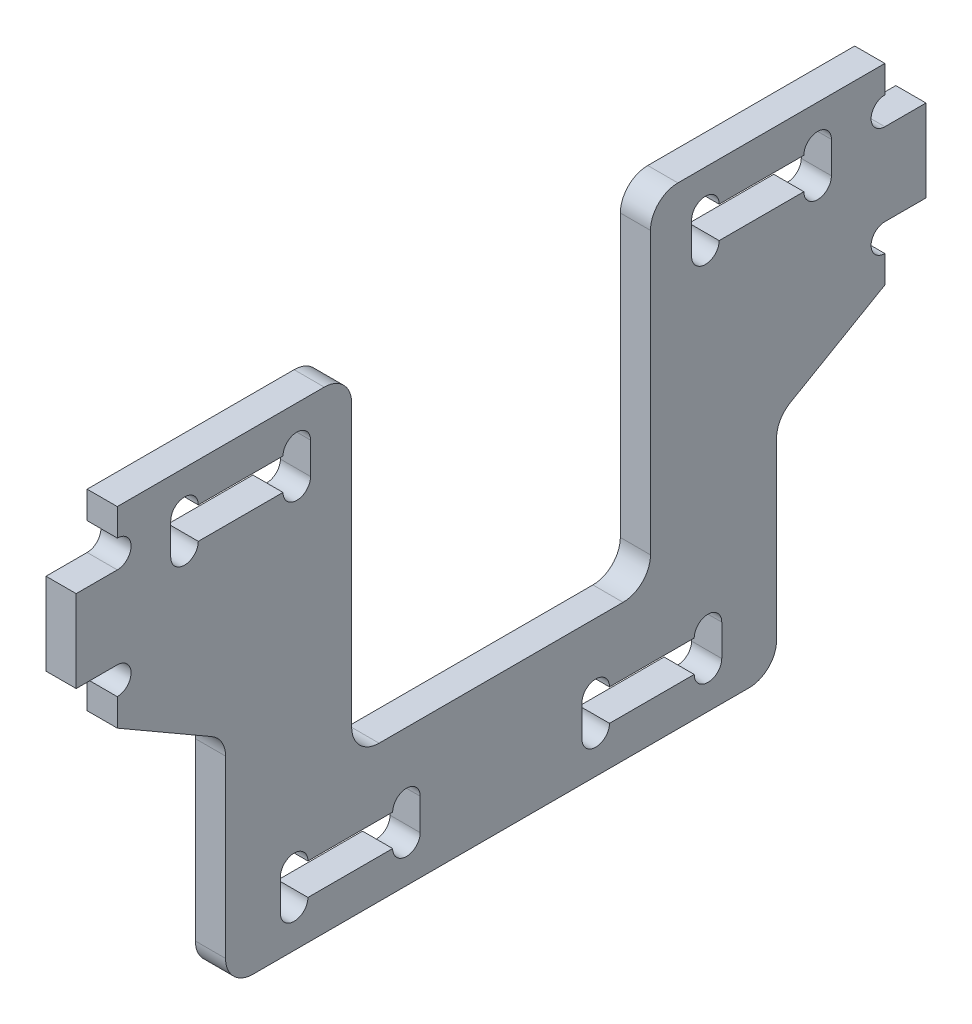
from build123d import *

# Parameters (mm, degrees)
EXTRUDE_1_DEPTH = 2.2
FILLET_1_R      = 2


with BuildPart() as part:
    # 草图1 → 凸台-拉伸1 (new body)
    with BuildSketch(Plane(origin=(0, 0, 0), x_dir=(0, 0, -1), z_dir=(1, 0, 0))):
        with BuildLine():
            Line((-20.1, -17.25), (20.1, -17.25))
            Line((20.1, -17.25), (20.1, -1.311067127))
            Line((20.1, -1.311067127), (28, 3.25))
            Line((28, 3.25), (28, 5.24))
            ThreePointArc((28, 5.24), (26.995, 6.245), (28, 7.25))
            Line((28, 7.25), (31, 7.25))
            Line((31, 7.25), (31, 13.25))
            Line((31, 13.25), (28, 13.25))
            ThreePointArc((28, 13.25), (26.995, 14.255), (28, 15.26))
            Line((28, 15.26), (28, 17.25))
            Line((28, 17.25), (10.9, 17.25))
            Line((10.9, 17.25), (10.9, -7.25))
            Line((10.9, -7.25), (-10.9, -7.25))
            Line((-10.9, -7.25), (-10.9, 17.25))
            Line((-10.9, 17.25), (-28, 17.25))
            Line((-28, 17.25), (-28, 15.26))
            ThreePointArc((-28, 15.26), (-27.289357685, 14.965642315), (-26.995, 14.255))
            ThreePointArc((-26.995, 14.255), (-27.289357685, 13.544357685), (-28, 13.25))
            Line((-28, 13.25), (-31, 13.25))
            Line((-31, 13.25), (-31, 7.25))
            Line((-31, 7.25), (-28, 7.25))
            ThreePointArc((-28, 7.25), (-27.289357685, 6.955642315), (-26.995, 6.245))
            ThreePointArc((-26.995, 6.245), (-27.289357685, 5.534357685), (-28, 5.24))
            Line((-28, 5.24), (-28, 3.25))
            Line((-28, 3.25), (-20.1, -1.311067127))
            Line((-20.1, -1.311067127), (-20.1, -17.25))
        make_face()
        with BuildLine():
            Line((-7.91, -14.4), (-14.09, -14.4))
            ThreePointArc((-14.09, -14.4), (-15.095, -15.405), (-16.1, -14.4))
            Line((-16.1, -14.4), (-16.1, -12.1))
            ThreePointArc((-16.1, -12.1), (-15.095, -11.095), (-14.09, -12.1))
            Line((-14.09, -12.1), (-7.91, -12.1))
            ThreePointArc((-7.91, -12.1), (-6.905, -11.095), (-5.9, -12.1))
            Line((-5.9, -12.1), (-5.9, -14.4))
            ThreePointArc((-5.9, -14.4), (-6.905, -15.405), (-7.91, -14.4))
        make_face(mode=Mode.SUBTRACT)
        with BuildLine():
            Line((16.1, -12.1), (16.1, -14.4))
            ThreePointArc((16.1, -14.4), (15.095, -15.405), (14.09, -14.4))
            Line((14.09, -14.4), (7.91, -14.4))
            ThreePointArc((7.91, -14.4), (6.905, -15.405), (5.9, -14.4))
            Line((5.9, -14.4), (5.9, -12.1))
            ThreePointArc((5.9, -12.1), (6.905, -11.095), (7.91, -12.1))
            Line((7.91, -12.1), (14.09, -12.1))
            ThreePointArc((14.09, -12.1), (15.095, -11.095), (16.1, -12.1))
        make_face(mode=Mode.SUBTRACT)
        with BuildLine():
            Line((-15.91, 12.1), (-22.09, 12.1))
            ThreePointArc((-22.09, 12.1), (-23.095, 11.095), (-24.1, 12.1))
            Line((-24.1, 12.1), (-24.1, 14.4))
            ThreePointArc((-24.1, 14.4), (-23.095, 15.405), (-22.09, 14.4))
            Line((-22.09, 14.4), (-15.91, 14.4))
            ThreePointArc((-15.91, 14.4), (-14.905, 15.405), (-13.9, 14.4))
            Line((-13.9, 14.4), (-13.9, 12.1))
            ThreePointArc((-13.9, 12.1), (-14.905, 11.095), (-15.91, 12.1))
        make_face(mode=Mode.SUBTRACT)
        with BuildLine():
            Line((13.9, 12.1), (13.9, 14.4))
            ThreePointArc((13.9, 14.4), (14.905, 15.405), (15.91, 14.4))
            Line((15.91, 14.4), (22.09, 14.4))
            ThreePointArc((22.09, 14.4), (23.095, 15.405), (24.1, 14.4))
            Line((24.1, 14.4), (24.1, 12.1))
            ThreePointArc((24.1, 12.1), (23.095, 11.095), (22.09, 12.1))
            Line((22.09, 12.1), (15.91, 12.1))
            ThreePointArc((15.91, 12.1), (14.905, 11.095), (13.9, 12.1))
        make_face(mode=Mode.SUBTRACT)
    extrude(amount=EXTRUDE_1_DEPTH)

    # 圆角1
    fillet_1_edges = [part.edges().sort_by_distance(p)[0] for p in [
        (1.1, -1.311067127, -20.1),
        (1.1, -17.25, -20.1),
        (1.1, -17.25, 20.1),
        (1.1, -1.311067127, 20.1),
        (1.1, 17.25, 10.9),
        (1.1, -7.25, 10.9),
        (1.1, -7.25, -10.9),
        (1.1, 17.25, -10.9),
    ]]
    fillet(fillet_1_edges, radius=FILLET_1_R)


solid = part.part
